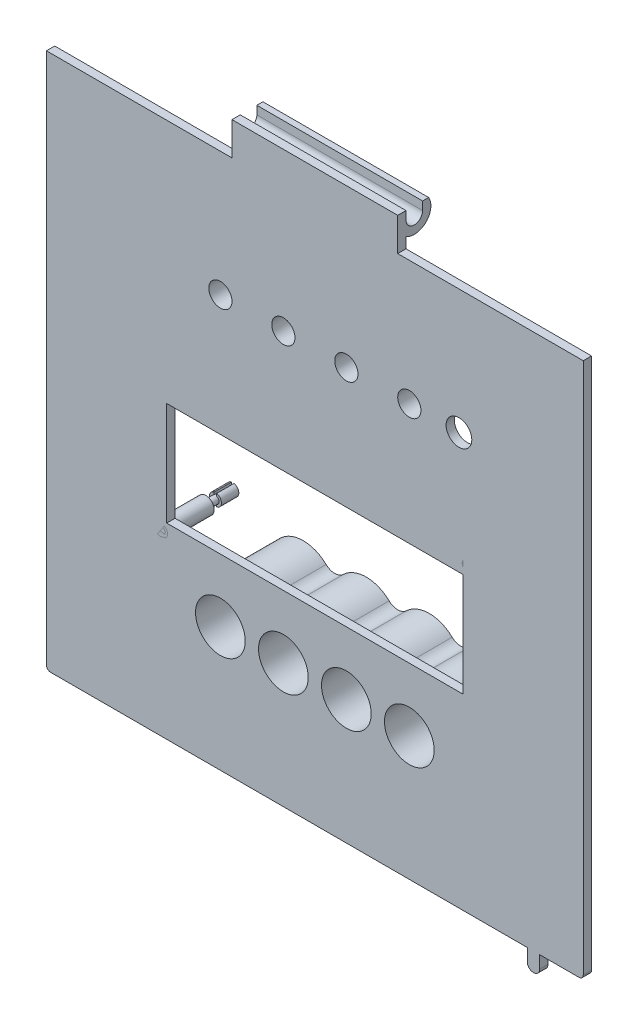
from build123d import *

# Parameters (mm, degrees)
SKETCH1_R                = 2
SKETCH1_W                = 71.5
SKETCH1_H                = 25
BOSS_EXTRUDE1_DEPTH      = 2
SKETCH1_R_2              = 1.45
BOSS_EXTRUDE1_2_DEPTH    = 2
BOSS_EXTRUDE1_3_DEPTH    = 2
BOSS_EXTRUDE1_4_DEPTH    = 2
BOSS_EXTRUDE1_5_DEPTH    = 2
SKETCH1_5_R              = 6
BOSS_EXTRUDE3_DEPTH      = 20
BOSS_EXTRUDE4_START      = -18
SKETCH1_6_R              = 6
SKETCH1_6_R_2            = 4
BOSS_EXTRUDE4_DEPTH      = 2
SKETCH1_7_R              = 2
BOSS_EXTRUDE5_DEPTH      = 10.7
SKETCH1_8_R              = 0.9
BOSS_EXTRUDE6_DEPTH      = 14.2
BOSS_EXTRUDE6_2_DEPTH    = 14.2
BOSS_EXTRUDE6_3_DEPTH    = 14.2
BOSS_EXTRUDE6_4_DEPTH    = 14.2
BOSS_EXTRUDE7_DEPTH      = 1.2
BOSS_EXTRUDE7_DEPTH_BACK = 3
BOSS_EXTRUDE7_START      = -14.2
SKETCH3_R                = 3.1
CUT_EXTRUDE1_DEPTH       = 4.2
SKETCH4_R                = 4.8
BOSS_EXTRUDE8_DEPTH      = 11
CUT_EXTRUDE2_DEPTH       = 10
CUT_EXTRUDE3_DEPTH       = 19
BOSS_EXTRUDE9_DEPTH      = 40
FILLET1_R                = 1


with BuildPart() as part:
    # Sketch1 → Boss-Extrude1 (new body)
    with BuildSketch(Plane.XY):
        with BuildLine():
            Line((-20, 64.7), (-64.775, 64.7))
            Line((-64.775, 64.7), (-64.775, -64.7))
            Line((-64.775, -64.7), (51.275, -64.7))
            Line((51.275, -64.7), (51.275, -67.7))
            ThreePointArc((51.275, -67.7), (52.775, -69.2), (54.275, -67.7))
            Line((54.275, -67.7), (54.275, -64.7))
            Line((54.275, -64.7), (64.775, -64.7))
            Line((64.775, -64.7), (64.775, 64.7))
            Line((64.775, 64.7), (20, 64.7))
            Line((20, 64.7), (20, 72.7))
            Line((20, 72.7), (-20, 72.7))
            Line((-20, 72.7), (-20, 64.7))
        make_face()
        with Locations((-37, -21.7)):
            Circle(SKETCH1_R, mode=Mode.SUBTRACT)
        with BuildLine():
            ThreePointArc((-17.272727273, -40.483533193), (-30.8, -34.7), (-17.272727273, -28.916466807))
            ThreePointArc((-17.272727273, -28.916466807), (-15.2, -29.747641859), (-13.127272727, -28.916466807))
            ThreePointArc((-13.127272727, -28.916466807), (-7.6, -26.7), (-2.072727273, -28.916466807))
            ThreePointArc((-2.072727273, -28.916466807), (0, -29.747641859), (2.072727273, -28.916466807))
            ThreePointArc((2.072727273, -28.916466807), (7.6, -26.7), (13.127272727, -28.916466807))
            ThreePointArc((13.127272727, -28.916466807), (15.2, -29.747641859), (17.272727273, -28.916466807))
            ThreePointArc((17.272727273, -28.916466807), (30.8, -34.7), (17.272727273, -40.483533193))
            ThreePointArc((17.272727273, -40.483533193), (15.2, -39.652358141), (13.127272727, -40.483533193))
            ThreePointArc((13.127272727, -40.483533193), (7.6, -42.7), (2.072727273, -40.483533193))
            ThreePointArc((2.072727273, -40.483533193), (0, -39.652358141), (-2.072727273, -40.483533193))
            ThreePointArc((-2.072727273, -40.483533193), (-7.6, -42.7), (-13.127272727, -40.483533193))
            ThreePointArc((-13.127272727, -40.483533193), (-15.2, -39.652358141), (-17.272727273, -40.483533193))
        make_face(mode=Mode.SUBTRACT)
        with Locations((0, -7)):
            Rectangle(SKETCH1_W, SKETCH1_H, mode=Mode.SUBTRACT)
        with Locations((37, -21.7)):
            Circle(SKETCH1_R, mode=Mode.SUBTRACT)
        with Locations((-37, 7.8)):
            Circle(SKETCH1_R, mode=Mode.SUBTRACT)
        with Locations((37, 7.8)):
            Circle(SKETCH1_R, mode=Mode.SUBTRACT)
    extrude(amount=-BOSS_EXTRUDE1_DEPTH)

    # Sketch1<5> → Boss-Extrude3 (add)
    with BuildSketch(Plane.XY):
        with BuildLine():
            ThreePointArc((-2.072727273, -28.916466807), (-7.6, -26.7), (-13.127272727, -28.916466807))
            ThreePointArc((-13.127272727, -28.916466807), (-15.2, -29.747641859), (-17.272727273, -28.916466807))
            ThreePointArc((-17.272727273, -28.916466807), (-30.8, -34.7), (-17.272727273, -40.483533193))
            ThreePointArc((-17.272727273, -40.483533193), (-15.2, -39.652358141), (-13.127272727, -40.483533193))
            ThreePointArc((-13.127272727, -40.483533193), (-7.6, -42.7), (-2.072727273, -40.483533193))
            ThreePointArc((-2.072727273, -40.483533193), (0, -39.652358141), (2.072727273, -40.483533193))
            ThreePointArc((2.072727273, -40.483533193), (7.6, -42.7), (13.127272727, -40.483533193))
            ThreePointArc((13.127272727, -40.483533193), (15.2, -39.652358141), (17.272727273, -40.483533193))
            ThreePointArc((17.272727273, -40.483533193), (30.8, -34.7), (17.272727273, -28.916466807))
            ThreePointArc((17.272727273, -28.916466807), (15.2, -29.747641859), (13.127272727, -28.916466807))
            ThreePointArc((13.127272727, -28.916466807), (7.6, -26.7), (2.072727273, -28.916466807))
            ThreePointArc((2.072727273, -28.916466807), (0, -29.747641859), (-2.072727273, -28.916466807))
        make_face()
        with Locations((-22.8, -34.7)):
            Circle(SKETCH1_5_R, mode=Mode.SUBTRACT)
        with Locations((-7.6, -34.7)):
            Circle(SKETCH1_5_R, mode=Mode.SUBTRACT)
        with Locations((7.6, -34.7)):
            Circle(SKETCH1_5_R, mode=Mode.SUBTRACT)
        with Locations((22.8, -34.7)):
            Circle(SKETCH1_5_R, mode=Mode.SUBTRACT)
    extrude(amount=-BOSS_EXTRUDE3_DEPTH)

    # Sketch1<6> → Boss-Extrude4 (add)
    # profile 1 of 4: a face of its own
    with BuildSketch(Plane.XY.offset(BOSS_EXTRUDE4_START)):
        with Locations((22.8, -34.7)):
            Circle(SKETCH1_6_R)
        with Locations((22.8, -34.7)):
            Circle(SKETCH1_6_R_2, mode=Mode.SUBTRACT)
    # profile 2 of 4: a face of its own
    with BuildSketch(Plane.XY.offset(BOSS_EXTRUDE4_START)):
        with Locations((7.6, -34.7)):
            Circle(SKETCH1_6_R)
        with Locations((7.6, -34.7)):
            Circle(SKETCH1_6_R_2, mode=Mode.SUBTRACT)
    # profile 3 of 4: a face of its own
    with BuildSketch(Plane.XY.offset(BOSS_EXTRUDE4_START)):
        with Locations((-7.6, -34.7)):
            Circle(SKETCH1_6_R)
        with Locations((-7.6, -34.7)):
            Circle(SKETCH1_6_R_2, mode=Mode.SUBTRACT)
    # profile 4 of 4: a face of its own
    with BuildSketch(Plane.XY.offset(BOSS_EXTRUDE4_START)):
        with Locations((-22.8, -34.7)):
            Circle(SKETCH1_6_R)
        with Locations((-22.8, -34.7)):
            Circle(SKETCH1_6_R_2, mode=Mode.SUBTRACT)
    extrude(amount=-BOSS_EXTRUDE4_DEPTH)

    # Sketch1<7> → Boss-Extrude5 (add)
    with BuildSketch(Plane.XY):
        with Locations((-37, 7.8)):
            Circle(SKETCH1_7_R)
        with Locations((-37, -21.7)):
            Circle(SKETCH1_7_R)
        with Locations((37, 7.8)):
            Circle(SKETCH1_7_R)
        with Locations((37, -21.7)):
            Circle(SKETCH1_7_R)
    extrude(amount=-BOSS_EXTRUDE5_DEPTH)

    # Sketch3 → Cut-Extrude1 (cut)
    with BuildSketch(Plane(origin=(0, 0, -2), x_dir=(-1, 0, 0), z_dir=(0, 0, -1))):
        with Locations((-34.775, 34.7)):
            Circle(SKETCH3_R)
    extrude(amount=-CUT_EXTRUDE1_DEPTH, mode=Mode.SUBTRACT)

    # Sketch4 → Boss-Extrude8 (add)
    with BuildSketch(Plane.XY):
        with Locations((-22.8, 34.7)):
            Circle(SKETCH4_R)
        with Locations((-7.6, 34.7)):
            Circle(SKETCH4_R)
        with Locations((7.6, 34.7)):
            Circle(SKETCH4_R)
        with Locations((22.8, 34.7)):
            Circle(SKETCH4_R)
    extrude(amount=-BOSS_EXTRUDE8_DEPTH)

    # Sketch4<4> → Cut-Extrude2 (cut)
    with BuildSketch(Plane.XY):
        with BuildLine():
            ThreePointArc((-20.307032535, 35.974799286), (-22.8, 37.5), (-25.292967465, 35.974799286))
            Line((-25.292967465, 35.974799286), (-20.307032535, 35.974799286))
        make_face()
        with BuildLine():
            Line((-20.307032535, 33.425200714), (-25.292967465, 33.425200714))
            ThreePointArc((-25.292967465, 33.425200714), (-22.8, 31.9), (-20.307032535, 33.425200714))
        make_face()
        with BuildLine():
            Line((-5.107032535, 33.425200714), (-10.092967465, 33.425200714))
            ThreePointArc((-10.092967465, 33.425200714), (-7.6, 31.9), (-5.107032535, 33.425200714))
        make_face()
        with BuildLine():
            ThreePointArc((-5.107032535, 35.974799286), (-7.6, 37.5), (-10.092967465, 35.974799286))
            Line((-10.092967465, 35.974799286), (-5.107032535, 35.974799286))
        make_face()
        with BuildLine():
            ThreePointArc((10.092967465, 35.974799286), (7.6, 37.5), (5.107032535, 35.974799286))
            Line((5.107032535, 35.974799286), (10.092967465, 35.974799286))
        make_face()
        with BuildLine():
            Line((10.092967465, 33.425200714), (5.107032535, 33.425200714))
            ThreePointArc((5.107032535, 33.425200714), (7.6, 31.9), (10.092967465, 33.425200714))
        make_face()
        with BuildLine():
            Line((25.292967465, 33.425200714), (20.307032535, 33.425200714))
            ThreePointArc((20.307032535, 33.425200714), (22.8, 31.9), (25.292967465, 33.425200714))
        make_face()
        with BuildLine():
            ThreePointArc((25.292967465, 35.974799286), (22.8, 37.5), (20.307032535, 35.974799286))
            Line((20.307032535, 35.974799286), (25.292967465, 35.974799286))
        make_face()
    extrude(amount=-CUT_EXTRUDE2_DEPTH, mode=Mode.SUBTRACT)

    # Sketch4<5> → Cut-Extrude3 (cut)
    with BuildSketch(Plane.XY):
        with BuildLine():
            ThreePointArc((20.307032535, 35.974799286), (20.077840113, 35.355626074), (20, 34.7))
            ThreePointArc((20, 34.7), (20.077840113, 34.044373926), (20.307032535, 33.425200714))
            Line((20.307032535, 33.425200714), (25.292967465, 33.425200714))
            ThreePointArc((25.292967465, 33.425200714), (25.6, 34.7), (25.292967465, 35.974799286))
            Line((25.292967465, 35.974799286), (20.307032535, 35.974799286))
        make_face()
        with BuildLine():
            ThreePointArc((-20.307032535, 33.425200714), (-20.077840113, 34.044373926), (-20, 34.7))
            ThreePointArc((-20, 34.7), (-20.077840113, 35.355626074), (-20.307032535, 35.974799286))
            Line((-20.307032535, 35.974799286), (-25.292967465, 35.974799286))
            ThreePointArc((-25.292967465, 35.974799286), (-25.6, 34.7), (-25.292967465, 33.425200714))
            Line((-25.292967465, 33.425200714), (-20.307032535, 33.425200714))
        make_face()
        with BuildLine():
            ThreePointArc((-10.092967465, 35.974799286), (-10.4, 34.7), (-10.092967465, 33.425200714))
            Line((-10.092967465, 33.425200714), (-5.107032535, 33.425200714))
            ThreePointArc((-5.107032535, 33.425200714), (-4.8, 34.7), (-5.107032535, 35.974799286))
            Line((-5.107032535, 35.974799286), (-10.092967465, 35.974799286))
        make_face()
        with BuildLine():
            ThreePointArc((5.107032535, 35.974799286), (4.8, 34.7), (5.107032535, 33.425200714))
            Line((5.107032535, 33.425200714), (10.092967465, 33.425200714))
            ThreePointArc((10.092967465, 33.425200714), (10.4, 34.7), (10.092967465, 35.974799286))
            Line((10.092967465, 35.974799286), (5.107032535, 35.974799286))
        make_face()
    extrude(amount=-CUT_EXTRUDE3_DEPTH, mode=Mode.SUBTRACT)

    # Sketch6 → Boss-Extrude9 (add)
    with BuildSketch(Plane.ZY.offset(20)):
        with BuildLine():
            Line((-6, 70.7), (-8, 70.7))
            ThreePointArc((-8, 70.7), (-6, 67.235898385), (-2, 67.235898385))
            Line((-2, 67.235898385), (-2, 70.7))
            ThreePointArc((-2, 70.7), (-4, 68.7), (-6, 70.7))
        make_face()
        with BuildLine():
            ThreePointArc((-7.464101615, 72.7), (-7.863703305, 71.73527618), (-8, 70.7))
            Line((-8, 70.7), (-6, 70.7))
            Line((-6, 70.7), (-6, 72.7))
            Line((-6, 72.7), (-7.464101615, 72.7))
        make_face()
    extrude(amount=-BOSS_EXTRUDE9_DEPTH)

    # Fillet1
    fillet1_edges = [part.edges().sort_by_distance(p)[0] for p in [
        (64.775, -64.7, -1),
        (-64.775, -64.7, -1),
    ]]
    fillet(fillet1_edges, radius=FILLET1_R)


with BuildPart() as body_2:
    # Sketch1 → Boss-Extrude1 2 (new body)
    with BuildSketch(Plane.XY):
        with Locations((37, 7.8)):
            Circle(SKETCH1_R_2)
    extrude(amount=-BOSS_EXTRUDE1_2_DEPTH)


with BuildPart() as body_3:
    # Sketch1 → Boss-Extrude1 3 (new body)
    with BuildSketch(Plane.XY):
        with Locations((37, -21.7)):
            Circle(SKETCH1_R_2)
    extrude(amount=-BOSS_EXTRUDE1_3_DEPTH)


with BuildPart() as body_4:
    # Sketch1 → Boss-Extrude1 4 (new body)
    with BuildSketch(Plane.XY):
        with Locations((-37, 7.8)):
            Circle(SKETCH1_R_2)
    extrude(amount=-BOSS_EXTRUDE1_4_DEPTH)


with BuildPart() as body_5:
    # Sketch1 → Boss-Extrude1 5 (new body)
    with BuildSketch(Plane.XY):
        with Locations((-37, -21.7)):
            Circle(SKETCH1_R_2)
    extrude(amount=-BOSS_EXTRUDE1_5_DEPTH)


with BuildPart() as body_6:
    # Sketch1<8> → Boss-Extrude6 (new body)
    with BuildSketch(Plane.XY):
        with Locations((37, -21.7)):
            Circle(SKETCH1_8_R)
    extrude(amount=-BOSS_EXTRUDE6_DEPTH)



with BuildPart() as body_7:
    # Sketch1<8> → Boss-Extrude6 2 (new body)
    with BuildSketch(Plane.XY):
        with Locations((37, 7.8)):
            Circle(SKETCH1_8_R)
    extrude(amount=-BOSS_EXTRUDE6_2_DEPTH)


with BuildPart() as body_8:
    # Sketch1<8> → Boss-Extrude6 3 (new body)
    with BuildSketch(Plane.XY):
        with Locations((-37, 7.8)):
            Circle(SKETCH1_8_R)
    extrude(amount=-BOSS_EXTRUDE6_3_DEPTH)


with BuildPart() as body_9:
    # Sketch1<8> → Boss-Extrude6 4 (new body)
    with BuildSketch(Plane.XY):
        with Locations((-37, -21.7)):
            Circle(SKETCH1_8_R)
    extrude(amount=-BOSS_EXTRUDE6_4_DEPTH)


with BuildPart() as body_6_1:
    add(body_6.part)

    add(body_7.part)  # Boss-Extrude7 merges body 7

    add(body_8.part)  # Boss-Extrude7 merges body 8

    add(body_9.part)  # Boss-Extrude7 merges body 9
    # Sketch1<9> → Boss-Extrude7 (add, two sides: drawn at the far end of the back side and taken through both)
    with BuildSketch(Plane.XY.offset(BOSS_EXTRUDE7_START - BOSS_EXTRUDE7_DEPTH_BACK)):
        with BuildLine():
            Line((-37.3, 8.648528137), (-37.3, 9.218626096))
            ThreePointArc((-37.3, 9.218626096), (-38.45, 7.8), (-37.3, 6.381373904))
            Line((-37.3, 6.381373904), (-37.3, 6.951471863))
            ThreePointArc((-37.3, 6.951471863), (-37.9, 7.8), (-37.3, 8.648528137))
        make_face()
        with BuildLine():
            Line((-37.3, 6.951471863), (-37.3, 8.648528137))
            ThreePointArc((-37.3, 8.648528137), (-37.9, 7.8), (-37.3, 6.951471863))
        make_face()
        with BuildLine():
            ThreePointArc((-36.1, 7.8), (-36.265153077, 8.319615242), (-36.7, 8.648528137))
            Line((-36.7, 8.648528137), (-36.7, 6.951471863))
            ThreePointArc((-36.7, 6.951471863), (-36.265153077, 7.280384758), (-36.1, 7.8))
        make_face()
        with BuildLine():
            ThreePointArc((-35.55, 7.8), (-35.873611967, 8.713099118), (-36.7, 9.218626096))
            Line((-36.7, 9.218626096), (-36.7, 8.648528137))
            ThreePointArc((-36.7, 8.648528137), (-36.265153077, 8.319615242), (-36.1, 7.8))
            ThreePointArc((-36.1, 7.8), (-36.265153077, 7.280384758), (-36.7, 6.951471863))
            Line((-36.7, 6.951471863), (-36.7, 6.381373904))
            ThreePointArc((-36.7, 6.381373904), (-35.873611967, 6.886900882), (-35.55, 7.8))
        make_face()
        with BuildLine():
            Line((-37.3, -22.548528137), (-37.3, -20.851471863))
            ThreePointArc((-37.3, -20.851471863), (-37.9, -21.7), (-37.3, -22.548528137))
        make_face()
        with BuildLine():
            ThreePointArc((-36.1, -21.7), (-36.265153077, -21.180384758), (-36.7, -20.851471863))
            Line((-36.7, -20.851471863), (-36.7, -22.548528137))
            ThreePointArc((-36.7, -22.548528137), (-36.265153077, -22.219615242), (-36.1, -21.7))
        make_face()
        with BuildLine():
            ThreePointArc((-35.55, -21.7), (-35.873611967, -20.786900882), (-36.7, -20.281373904))
            Line((-36.7, -20.281373904), (-36.7, -20.851471863))
            ThreePointArc((-36.7, -20.851471863), (-36.265153077, -21.180384758), (-36.1, -21.7))
            ThreePointArc((-36.1, -21.7), (-36.265153077, -22.219615242), (-36.7, -22.548528137))
            Line((-36.7, -22.548528137), (-36.7, -23.118626096))
            ThreePointArc((-36.7, -23.118626096), (-35.873611967, -22.613099118), (-35.55, -21.7))
        make_face()
        with BuildLine():
            Line((-37.3, -20.851471863), (-37.3, -20.281373904))
            ThreePointArc((-37.3, -20.281373904), (-38.45, -21.7), (-37.3, -23.118626096))
            Line((-37.3, -23.118626096), (-37.3, -22.548528137))
            ThreePointArc((-37.3, -22.548528137), (-37.9, -21.7), (-37.3, -20.851471863))
        make_face()
        with BuildLine():
            Line((36.7, -20.851471863), (36.7, -20.281373904))
            ThreePointArc((36.7, -20.281373904), (35.55, -21.7), (36.7, -23.118626096))
            Line((36.7, -23.118626096), (36.7, -22.548528137))
            ThreePointArc((36.7, -22.548528137), (36.1, -21.7), (36.7, -20.851471863))
        make_face()
        with BuildLine():
            Line((36.7, 8.648528137), (36.7, 9.218626096))
            ThreePointArc((36.7, 9.218626096), (35.55, 7.8), (36.7, 6.381373904))
            Line((36.7, 6.381373904), (36.7, 6.951471863))
            ThreePointArc((36.7, 6.951471863), (36.1, 7.8), (36.7, 8.648528137))
        make_face()
        with BuildLine():
            ThreePointArc((38.45, -21.7), (38.126388033, -20.786900882), (37.3, -20.281373904))
            Line((37.3, -20.281373904), (37.3, -20.851471863))
            ThreePointArc((37.3, -20.851471863), (37.734846923, -21.180384758), (37.9, -21.7))
            ThreePointArc((37.9, -21.7), (37.734846923, -22.219615242), (37.3, -22.548528137))
            Line((37.3, -22.548528137), (37.3, -23.118626096))
            ThreePointArc((37.3, -23.118626096), (38.126388033, -22.613099118), (38.45, -21.7))
        make_face()
        with BuildLine():
            ThreePointArc((37.9, 7.8), (37.734846923, 8.319615242), (37.3, 8.648528137))
            Line((37.3, 8.648528137), (37.3, 6.951471863))
            ThreePointArc((37.3, 6.951471863), (37.734846923, 7.280384758), (37.9, 7.8))
        make_face()
        with BuildLine():
            ThreePointArc((38.45, 7.8), (38.126388033, 8.713099118), (37.3, 9.218626096))
            Line((37.3, 9.218626096), (37.3, 8.648528137))
            ThreePointArc((37.3, 8.648528137), (37.734846923, 8.319615242), (37.9, 7.8))
            ThreePointArc((37.9, 7.8), (37.734846923, 7.280384758), (37.3, 6.951471863))
            Line((37.3, 6.951471863), (37.3, 6.381373904))
            ThreePointArc((37.3, 6.381373904), (38.126388033, 6.886900882), (38.45, 7.8))
        make_face()
        with BuildLine():
            Line((36.7, 6.951471863), (36.7, 8.648528137))
            ThreePointArc((36.7, 8.648528137), (36.1, 7.8), (36.7, 6.951471863))
        make_face()
        with BuildLine():
            ThreePointArc((37.9, -21.7), (37.734846923, -21.180384758), (37.3, -20.851471863))
            Line((37.3, -20.851471863), (37.3, -22.548528137))
            ThreePointArc((37.3, -22.548528137), (37.734846923, -22.219615242), (37.9, -21.7))
        make_face()
        with BuildLine():
            Line((36.7, -22.548528137), (36.7, -20.851471863))
            ThreePointArc((36.7, -20.851471863), (36.1, -21.7), (36.7, -22.548528137))
        make_face()
    extrude(amount=BOSS_EXTRUDE7_DEPTH + BOSS_EXTRUDE7_DEPTH_BACK)


solid = Compound([part.part, body_2.part, body_3.part, body_4.part, body_5.part, body_6_1.part])
